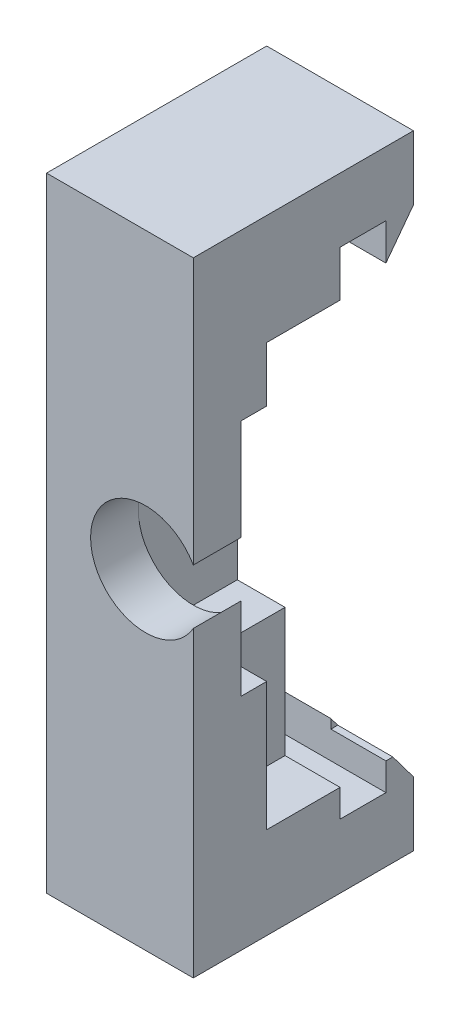
from build123d import *

# Parameters (mm, degrees)
SKETCH1_W           = 4
SKETCH1_H           = 17
BOSS_EXTRUDE1_DEPTH = 6
SKETCH2_W           = 2.8
SKETCH2_H           = 6.5
SKETCH2_W_2         = 1.5
SKETCH2_H_2         = 2.75
CUT_EXTRUDE1_DEPTH  = 19.466185313
CUT_EXTRUDE2_DEPTH  = 19.466185313
SKETCH4_W           = 2
SKETCH4_H           = 2.75
BOSS_EXTRUDE2_DEPTH = 2
SKETCH6_W           = 1.5
SKETCH6_H           = 1.5
SKETCH6_H_2         = 0.75
CUT_EXTRUDE3_DEPTH  = 2
SKETCH7_W           = 1.3
SKETCH7_H           = 6.5
BOSS_EXTRUDE3_DEPTH = 2.8
SKETCH8_R           = 1.5
CUT_EXTRUDE4_DEPTH  = 10


with BuildPart() as part:
    # Sketch1 → Boss-Extrude1 (new body)
    with BuildSketch(Plane.XY):
        with Locations((2, 8.5)):
            Rectangle(SKETCH1_W, SKETCH1_H)
    extrude(amount=BOSS_EXTRUDE1_DEPTH)

    # Sketch2 → Cut-Extrude1 (cut, through all)
    with BuildSketch(Plane.XY.offset(6)):
        with Locations((2.6, 9.25)):
            Rectangle(SKETCH2_W, SKETCH2_H)
        with Locations((3.25, 3.875)):
            Rectangle(SKETCH2_W_2, SKETCH2_H_2)
    extrude(amount=-CUT_EXTRUDE1_DEPTH, mode=Mode.SUBTRACT)

    # Sketch3 → Cut-Extrude2 (cut, through all)
    with BuildSketch(Plane.ZY):
        Polygon((0, 15.25), (0.75, 14.25), (0.75, 15.25), (2, 15.25), (2, 1.75), (0.75, 1.75), (0.75, 2.75), (0, 1.75), align=None)
    extrude(amount=-CUT_EXTRUDE2_DEPTH, mode=Mode.SUBTRACT)

    # Sketch4 → Boss-Extrude2 (add)
    with BuildSketch(Plane(origin=(4, 0, 0), x_dir=(0, 0, -1), z_dir=(1, 0, 0))):
        with Locations((-5, 3.875)):
            Rectangle(SKETCH4_W, SKETCH4_H)
    extrude(amount=-BOSS_EXTRUDE2_DEPTH)

    # Sketch6 → Cut-Extrude3 (cut)
    with BuildSketch(Plane(origin=(0, 0, 2), x_dir=(-1, 0, 0), z_dir=(0, 0, -1))):
        with Locations((-3.25, 13.25)):
            Rectangle(SKETCH6_W, SKETCH6_H)
        with Locations((-3.25, 5.625)):
            Rectangle(SKETCH6_W, SKETCH6_H_2)
    extrude(amount=-CUT_EXTRUDE3_DEPTH, mode=Mode.SUBTRACT)

    # Sketch7 → Boss-Extrude3 (add)
    with BuildSketch(Plane(origin=(1.2, 0, 0), x_dir=(0, 0, -1), z_dir=(1, 0, 0))):
        with Locations((-5.35, 9.25)):
            Rectangle(SKETCH7_W, SKETCH7_H)
    extrude(amount=BOSS_EXTRUDE3_DEPTH)

    # Sketch8 → Cut-Extrude4 (cut)
    with BuildSketch(Plane(origin=(0, 0, 4.7), x_dir=(-1, 0, 0), z_dir=(0, 0, -1))):
        with Locations((-2.7, 9)):
            Circle(SKETCH8_R)
    extrude(amount=-CUT_EXTRUDE4_DEPTH, mode=Mode.SUBTRACT)


solid = part.part
